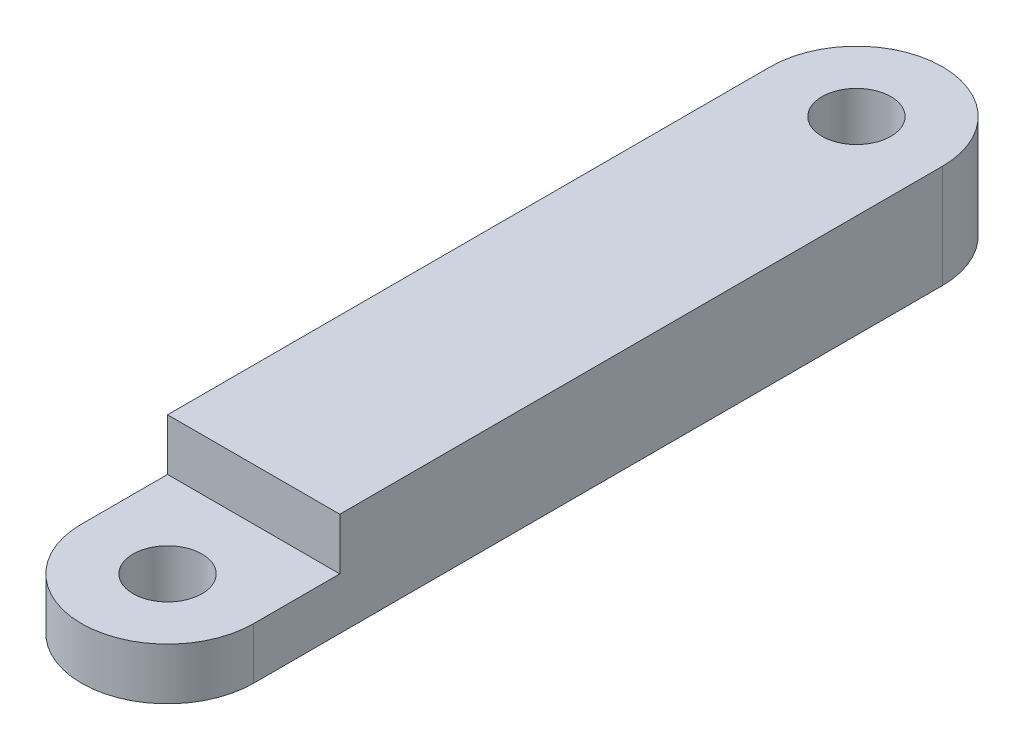
from build123d import *

# Parameters (mm, degrees)
BOSS_EXTRU_1_DEPTH      = 3
BOSS_EXTRU_1_DEPTH_BACK = 3
ESQUISSE1_R             = 2
ESQUISSE2_W             = 10
ESQUISSE2_H             = 11.041575451
ENL_V_MAT_EXTRU_1_DEPTH = 3


with BuildPart() as part:
    # Esquisse1 → Boss.-Extru.1 (new, two sides: drawn at the far end of the back side and taken through both)
    with BuildSketch(Plane(origin=(0, 0, 0), x_dir=(1, 0, 0), z_dir=(0, 1, 0)).offset(-BOSS_EXTRU_1_DEPTH_BACK)):
        with BuildLine():
            Line((-5, 0), (-5, -40))
            ThreePointArc((-5, -40), (0, -45), (5, -40))
            Line((5, -40), (5, 0))
            ThreePointArc((5, 0), (0, 5), (-5, 0))
        make_face()
        with Locations((0, -40)):
            Circle(ESQUISSE1_R, mode=Mode.SUBTRACT)
        Circle(ESQUISSE1_R, mode=Mode.SUBTRACT)
    extrude(amount=BOSS_EXTRU_1_DEPTH + BOSS_EXTRU_1_DEPTH_BACK)

    # Esquisse2 → Enlèv. mat.-Extru.1 (cut)
    with BuildSketch(Plane(origin=(0, 3, 0), x_dir=(1, 0, 0), z_dir=(0, 1, 0))):
        with Locations((0, -40.520787725)):
            Rectangle(ESQUISSE2_W, ESQUISSE2_H)
    extrude(amount=-ENL_V_MAT_EXTRU_1_DEPTH, mode=Mode.SUBTRACT)


solid = part.part
